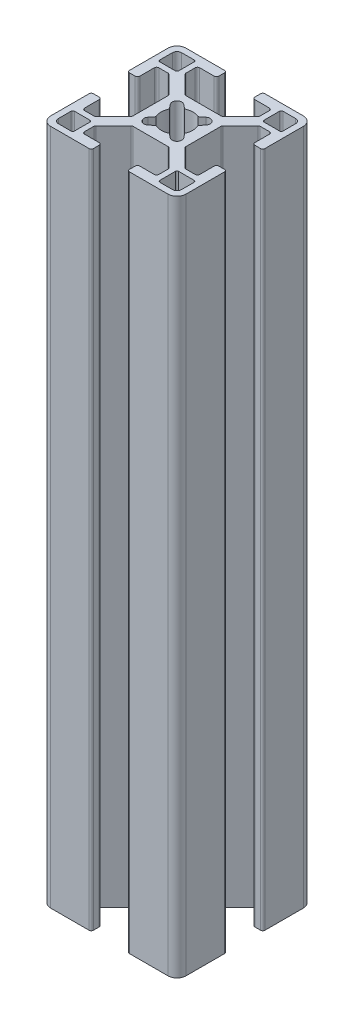
from build123d import *

# Parameters (mm, degrees)
PERFIL_COM_ALUMINIO_PERFIL_COMER_30_X_DEPTH = 150
DURCHGANGSLOCH_F_R_M51_D                    = 5.3


with BuildPart() as part:
    # Esboço1 → Perfil com. aluminio PERFIL COMER. 30 X 30(1) (new body)
    with BuildSketch(Plane(origin=(0, 0, 0), x_dir=(1, 0, 0), z_dir=(0, 1, 0))):
        with BuildLine():
            Line((0, 5.872725395), (-3.872893219, 5.872725395))
            ThreePointArc((-3.872893219, 5.872725395), (-4.064234935, 5.910785628), (-4.226446609, 6.019172004))
            Line((-4.226446609, 6.019172004), (-8.073553391, 9.866278785))
            ThreePointArc((-8.073553391, 9.866278785), (-8.181939766, 10.02849046), (-8.22, 10.219832176))
            Line((-8.22, 10.219832176), (-8.22, 12.25))
            ThreePointArc((-8.22, 12.25), (-8.073553391, 12.603553391), (-7.72, 12.75))
            Line((-7.72, 12.75), (-4.5, 12.75))
            ThreePointArc((-4.5, 12.75), (-4.146446609, 12.896446609), (-4, 13.25))
            Line((-4, 13.25), (-4, 14.5))
            ThreePointArc((-4, 14.5), (-4.146446609, 14.853553391), (-4.5, 15))
            Line((-4.5, 15), (-13, 15))
            ThreePointArc((-13, 15), (-14.414213562, 14.414213562), (-15, 13))
            Line((-15, 13), (-15, 4.5))
            ThreePointArc((-15, 4.5), (-14.853553391, 4.146446609), (-14.5, 4))
            Line((-14.5, 4), (-13.25, 4))
            ThreePointArc((-13.25, 4), (-12.896446609, 4.146446609), (-12.75, 4.5))
            Line((-12.75, 4.5), (-12.75, 7.72))
            ThreePointArc((-12.75, 7.72), (-12.603553391, 8.073553391), (-12.25, 8.22))
            Line((-12.25, 8.22), (-10.219832176, 8.22))
            ThreePointArc((-10.219832176, 8.22), (-10.02849046, 8.181939766), (-9.866278785, 8.073553391))
            Line((-9.866278785, 8.073553391), (-6.019172004, 4.226446609))
            ThreePointArc((-6.019172004, 4.226446609), (-5.910785628, 4.064234935), (-5.872725395, 3.872893219))
            Line((-5.872725395, 3.872893219), (-5.872725395, 0))
            Line((-5.872725395, 0), (-5.872725395, -3.872893219))
            ThreePointArc((-5.872725395, -3.872893219), (-5.910785628, -4.064234935), (-6.019172004, -4.226446609))
            Line((-6.019172004, -4.226446609), (-9.866278785, -8.073553391))
            ThreePointArc((-9.866278785, -8.073553391), (-10.02849046, -8.181939766), (-10.219832176, -8.22))
            Line((-10.219832176, -8.22), (-12.25, -8.22))
            ThreePointArc((-12.25, -8.22), (-12.603553391, -8.073553391), (-12.75, -7.72))
            Line((-12.75, -7.72), (-12.75, -4.5))
            ThreePointArc((-12.75, -4.5), (-12.896446609, -4.146446609), (-13.25, -4))
            Line((-13.25, -4), (-14.5, -4))
            ThreePointArc((-14.5, -4), (-14.853553391, -4.146446609), (-15, -4.5))
            Line((-15, -4.5), (-15, -13))
            ThreePointArc((-15, -13), (-14.414213562, -14.414213562), (-13, -15))
            Line((-13, -15), (-4.5, -15))
            ThreePointArc((-4.5, -15), (-4.146446609, -14.853553391), (-4, -14.5))
            Line((-4, -14.5), (-4, -13.25))
            ThreePointArc((-4, -13.25), (-4.146446609, -12.896446609), (-4.5, -12.75))
            Line((-4.5, -12.75), (-7.72, -12.75))
            ThreePointArc((-7.72, -12.75), (-8.073553391, -12.603553391), (-8.22, -12.25))
            Line((-8.22, -12.25), (-8.22, -10.219832176))
            ThreePointArc((-8.22, -10.219832176), (-8.181939766, -10.02849046), (-8.073553391, -9.866278785))
            Line((-8.073553391, -9.866278785), (-4.226446609, -6.019172004))
            ThreePointArc((-4.226446609, -6.019172004), (-4.064234935, -5.910785628), (-3.872893219, -5.872725395))
            Line((-3.872893219, -5.872725395), (0, -5.872725395))
            Line((0, -5.872725395), (3.872893219, -5.872725395))
            ThreePointArc((3.872893219, -5.872725395), (4.064234935, -5.910785628), (4.226446609, -6.019172004))
            Line((4.226446609, -6.019172004), (8.073553391, -9.866278785))
            ThreePointArc((8.073553391, -9.866278785), (8.181939766, -10.02849046), (8.22, -10.219832176))
            Line((8.22, -10.219832176), (8.22, -12.25))
            ThreePointArc((8.22, -12.25), (8.073553391, -12.603553391), (7.72, -12.75))
            Line((7.72, -12.75), (4.5, -12.75))
            ThreePointArc((4.5, -12.75), (4.146446609, -12.896446609), (4, -13.25))
            Line((4, -13.25), (4, -14.5))
            ThreePointArc((4, -14.5), (4.146446609, -14.853553391), (4.5, -15))
            Line((4.5, -15), (13, -15))
            ThreePointArc((13, -15), (14.414213562, -14.414213562), (15, -13))
            Line((15, -13), (15, -4.5))
            ThreePointArc((15, -4.5), (14.853553391, -4.146446609), (14.5, -4))
            Line((14.5, -4), (13.25, -4))
            ThreePointArc((13.25, -4), (12.896446609, -4.146446609), (12.75, -4.5))
            Line((12.75, -4.5), (12.75, -7.72))
            ThreePointArc((12.75, -7.72), (12.603553391, -8.073553391), (12.25, -8.22))
            Line((12.25, -8.22), (10.219832176, -8.22))
            ThreePointArc((10.219832176, -8.22), (10.02849046, -8.181939766), (9.866278785, -8.073553391))
            Line((9.866278785, -8.073553391), (6.019172004, -4.226446609))
            ThreePointArc((6.019172004, -4.226446609), (5.910785628, -4.064234935), (5.872725395, -3.872893219))
            Line((5.872725395, -3.872893219), (5.872725395, 0))
            Line((5.872725395, 0), (5.872725395, 3.872893219))
            ThreePointArc((5.872725395, 3.872893219), (5.910785628, 4.064234935), (6.019172004, 4.226446609))
            Line((6.019172004, 4.226446609), (9.866278785, 8.073553391))
            ThreePointArc((9.866278785, 8.073553391), (10.02849046, 8.181939766), (10.219832176, 8.22))
            Line((10.219832176, 8.22), (12.25, 8.22))
            ThreePointArc((12.25, 8.22), (12.603553391, 8.073553391), (12.75, 7.72))
            Line((12.75, 7.72), (12.75, 4.5))
            ThreePointArc((12.75, 4.5), (12.896446609, 4.146446609), (13.25, 4))
            Line((13.25, 4), (14.5, 4))
            ThreePointArc((14.5, 4), (14.853553391, 4.146446609), (15, 4.5))
            Line((15, 4.5), (15, 13))
            ThreePointArc((15, 13), (14.414213562, 14.414213562), (13, 15))
            Line((13, 15), (4.5, 15))
            ThreePointArc((4.5, 15), (4.146446609, 14.853553391), (4, 14.5))
            Line((4, 14.5), (4, 13.25))
            ThreePointArc((4, 13.25), (4.146446609, 12.896446609), (4.5, 12.75))
            Line((4.5, 12.75), (7.72, 12.75))
            ThreePointArc((7.72, 12.75), (8.073553391, 12.603553391), (8.22, 12.25))
            Line((8.22, 12.25), (8.22, 10.219832176))
            ThreePointArc((8.22, 10.219832176), (8.181939766, 10.02849046), (8.073553391, 9.866278785))
            Line((8.073553391, 9.866278785), (4.226446609, 6.019172004))
            ThreePointArc((4.226446609, 6.019172004), (4.064234935, 5.910785628), (3.872893219, 5.872725395))
            Line((3.872893219, 5.872725395), (0, 5.872725395))
        make_face()
        with BuildLine():
            Line((-3.184880901, 1.488031663), (-3.963428513, 2.463089414))
            ThreePointArc((-3.963428513, 2.463089414), (-3.884059168, 3.884060272), (-2.463088278, 3.963429044))
            Line((-2.463088278, 3.963429044), (-1.488030527, 3.184881432))
            ThreePointArc((-1.488030527, 3.184881432), (-0.762142415, 3.431740597), (6.27e-07, 3.515352697))
            ThreePointArc((6.27e-07, 3.515352697), (0.762143639, 3.431740325), (1.488031663, 3.184880901))
            Line((1.488031663, 3.184880901), (2.463089414, 3.963428513))
            ThreePointArc((2.463089414, 3.963428513), (3.884060272, 3.884059168), (3.963429044, 2.463088278))
            Line((3.963429044, 2.463088278), (3.184881432, 1.488030527))
            ThreePointArc((3.184881432, 1.488030527), (3.431740597, 0.762142415), (3.515352697, -6.27e-07))
            ThreePointArc((3.515352697, -6.27e-07), (3.431740325, -0.762143639), (3.184880901, -1.488031663))
            Line((3.184880901, -1.488031663), (3.963428513, -2.463089414))
            ThreePointArc((3.963428513, -2.463089414), (3.884059168, -3.884060272), (2.463088278, -3.963429044))
            Line((2.463088278, -3.963429044), (1.488030527, -3.184881432))
            ThreePointArc((1.488030527, -3.184881432), (0.762142415, -3.431740597), (-6.27e-07, -3.515352697))
            ThreePointArc((-6.27e-07, -3.515352697), (-0.762143639, -3.431740325), (-1.488031663, -3.184880901))
            Line((-1.488031663, -3.184880901), (-2.463089414, -3.963428513))
            ThreePointArc((-2.463089414, -3.963428513), (-3.884060272, -3.884059168), (-3.963429044, -2.463088278))
            Line((-3.963429044, -2.463088278), (-3.184881432, -1.488030527))
            ThreePointArc((-3.184881432, -1.488030527), (-3.431740597, -0.762142415), (-3.515352697, 6.27e-07))
            ThreePointArc((-3.515352697, 6.27e-07), (-3.431740325, 0.762143639), (-3.184880901, 1.488031663))
        make_face(mode=Mode.SUBTRACT)
        with BuildLine():
            Line((-9.46, 13.26), (-9.46, 9.84))
            ThreePointArc((-9.46, 9.84), (-9.571299423, 9.571299423), (-9.84, 9.46))
            Line((-9.84, 9.46), (-13.26, 9.46))
            ThreePointArc((-13.26, 9.46), (-13.528700577, 9.571299423), (-13.64, 9.84))
            Line((-13.64, 9.84), (-13.64, 12.64))
            ThreePointArc((-13.64, 12.64), (-13.347106781, 13.347106781), (-12.64, 13.64))
            Line((-12.64, 13.64), (-9.84, 13.64))
            ThreePointArc((-9.84, 13.64), (-9.571299423, 13.528700577), (-9.46, 13.26))
        make_face(mode=Mode.SUBTRACT)
        with BuildLine():
            Line((13.64, 12.64), (13.64, 9.84))
            ThreePointArc((13.64, 9.84), (13.528700577, 9.571299423), (13.26, 9.46))
            Line((13.26, 9.46), (9.84, 9.46))
            ThreePointArc((9.84, 9.46), (9.571299423, 9.571299423), (9.46, 9.84))
            Line((9.46, 9.84), (9.46, 13.26))
            ThreePointArc((9.46, 13.26), (9.571299423, 13.528700577), (9.84, 13.64))
            Line((9.84, 13.64), (12.64, 13.64))
            ThreePointArc((12.64, 13.64), (13.347106781, 13.347106781), (13.64, 12.64))
        make_face(mode=Mode.SUBTRACT)
        with BuildLine():
            Line((12.64, -13.64), (9.84, -13.64))
            ThreePointArc((9.84, -13.64), (9.571299423, -13.528700577), (9.46, -13.26))
            Line((9.46, -13.26), (9.46, -9.84))
            ThreePointArc((9.46, -9.84), (9.571299423, -9.571299423), (9.84, -9.46))
            Line((9.84, -9.46), (13.26, -9.46))
            ThreePointArc((13.26, -9.46), (13.528700577, -9.571299423), (13.64, -9.84))
            Line((13.64, -9.84), (13.64, -12.64))
            ThreePointArc((13.64, -12.64), (13.347106781, -13.347106781), (12.64, -13.64))
        make_face(mode=Mode.SUBTRACT)
        with BuildLine():
            Line((-13.64, -12.64), (-13.64, -9.84))
            ThreePointArc((-13.64, -9.84), (-13.528700577, -9.571299423), (-13.26, -9.46))
            Line((-13.26, -9.46), (-9.84, -9.46))
            ThreePointArc((-9.84, -9.46), (-9.571299423, -9.571299423), (-9.46, -9.84))
            Line((-9.46, -9.84), (-9.46, -13.26))
            ThreePointArc((-9.46, -13.26), (-9.571299423, -13.528700577), (-9.84, -13.64))
            Line((-9.84, -13.64), (-12.64, -13.64))
            ThreePointArc((-12.64, -13.64), (-13.347106781, -13.347106781), (-13.64, -12.64))
        make_face(mode=Mode.SUBTRACT)
    extrude(amount=PERFIL_COM_ALUMINIO_PERFIL_COMER_30_X_DEPTH)

    # Durchgangsloch für M51 (through all)
    with Locations(Plane(origin=(0, 120, 5.872725395), x_dir=(1, 0, 0), z_dir=(0, 0, 1))):
        with Locations((0, 0), (0, -50)):
            Hole(DURCHGANGSLOCH_F_R_M51_D / 2)


solid = part.part
